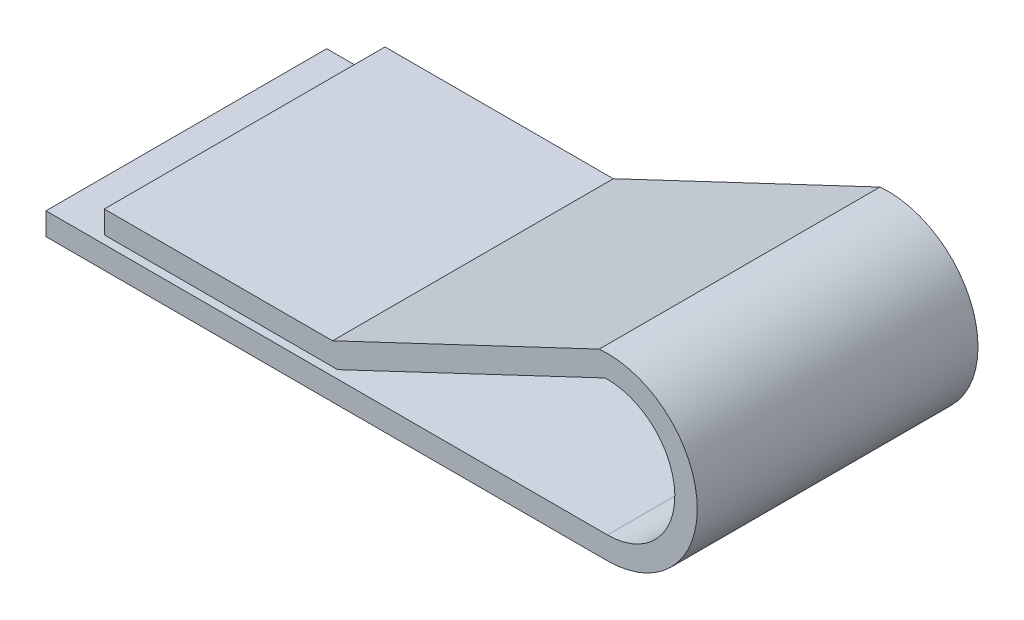
from build123d import *

# Parameters (mm, degrees)
EXTRUDE_THIN1_DEPTH = 12.5


with BuildPart() as part:
    # Sketch1 → Extrude-Thin1 (new, symmetric)
    with BuildSketch(Plane.XY):
        with BuildLine():
            Line((-40.077255037, 0), (9.922744963, 0))
            ThreePointArc((9.922744963, 0), (15.921746314, 6.10946594), (9.703849522, 11.996005736))
            Line((9.703849522, 11.996005736), (-14.107622933, 0.733850653))
            Line((-14.107622933, 0.733850653), (-34.885582543, 0.733850653))
            Line((-34.885582543, 0.733850653), (-34.885582543, 2.733850653))
            Line((-34.885582543, 2.733850653), (-14.556743985, 2.733850653))
            Line((-14.556743985, 2.733850653), (9.192574096, 13.966608469))
            ThreePointArc((9.192574096, 13.966608469), (17.914392721, 6.365466992), (9.922744963, -2))
            Line((9.922744963, -2), (-40.077255037, -2))
            Line((-40.077255037, -2), (-40.077255037, 0))
        make_face()
    extrude(amount=EXTRUDE_THIN1_DEPTH, both=True)


solid = part.part
